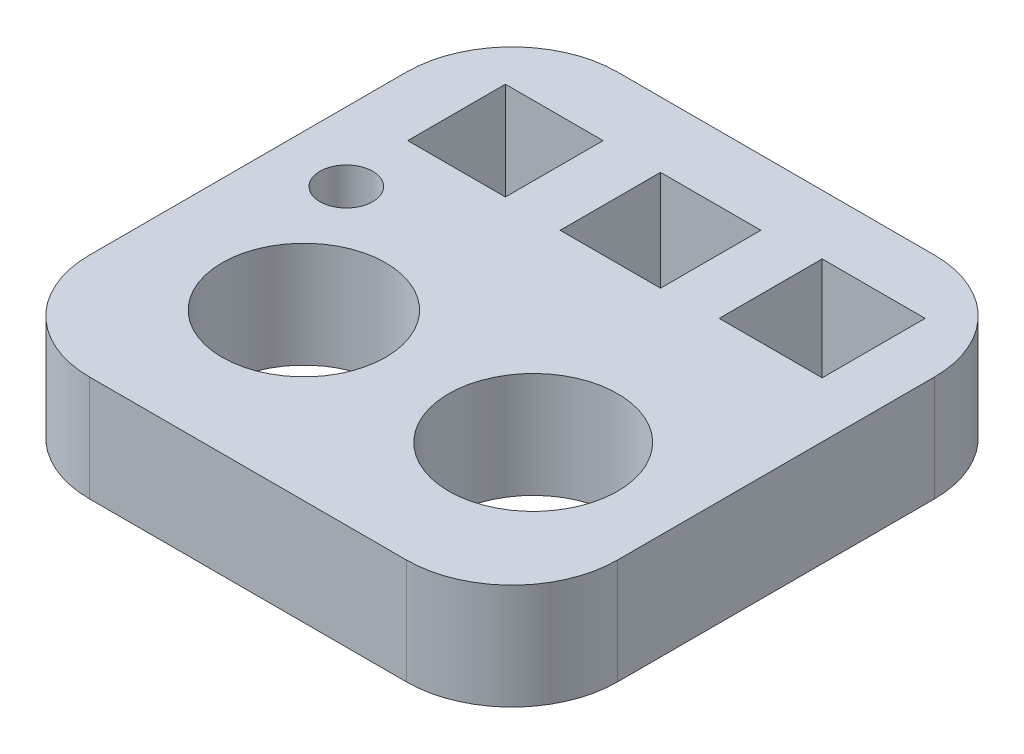
from build123d import *

# Parameters (mm, degrees)
SKETCH1_W           = 10
SKETCH1_H           = 10
BOSS_EXTRUDE1_DEPTH = 2
SKETCH2_R           = 1.55
SKETCH2_R_2         = 1.6
SKETCH2_R_3         = 0.5
SKETCH2_W           = 1.85
SKETCH2_H           = 1.85
SKETCH2_W_2         = 1.95
SKETCH2_H_2         = 1.95
SKETCH2_W_3         = 1.9
SKETCH2_H_3         = 1.9
CUT_EXTRUDE1_DEPTH  = 10
FILLET1_R           = 2


with BuildPart() as part:
    # Sketch1 → Boss-Extrude1 (new body)
    with BuildSketch(Plane(origin=(0, 0, 0), x_dir=(1, 0, 0), z_dir=(0, 1, 0))):
        with Locations((-46.016664058, -38.292528072)):
            Rectangle(SKETCH1_W, SKETCH1_H)
    extrude(amount=BOSS_EXTRUDE1_DEPTH)

    # Sketch2 → Cut-Extrude1 (cut)
    with BuildSketch(Plane(origin=(0, 2, 0), x_dir=(1, 0, 0), z_dir=(0, 1, 0))):
        with Locations(Location((-48.08551258, -40.164750495, 0), (0, 0, 270))):
            Circle(SKETCH2_R)
        with Locations(Location((-43.742640476, -40.164750495, 0), (0, 0, 270))):
            Circle(SKETCH2_R_2)
        with Locations(Location((-49.709815138, -37.736845618, 0), (0, 0, 270))):
            Circle(SKETCH2_R_3)
        with Locations((-48.955794355, -35.478207728)):
            Rectangle(SKETCH2_W, SKETCH2_H)
        with Locations((-43.041207223, -35.394011884)):
            Rectangle(SKETCH2_W_2, SKETCH2_H_2)
        with Locations((-46.016664058, -35.479919958)):
            Rectangle(SKETCH2_W_3, SKETCH2_H_3)
    extrude(amount=-CUT_EXTRUDE1_DEPTH, mode=Mode.SUBTRACT)

    # Fillet1
    fillet1_edges = [part.edges().sort_by_distance(p)[0] for p in [
        (-51.016664058, 1, 33.292528072),
        (-41.016664058, 1, 33.292528072),
        (-41.016664058, 1, 43.292528072),
        (-51.016664058, 1, 43.292528072),
    ]]
    fillet(fillet1_edges, radius=FILLET1_R)


solid = part.part
